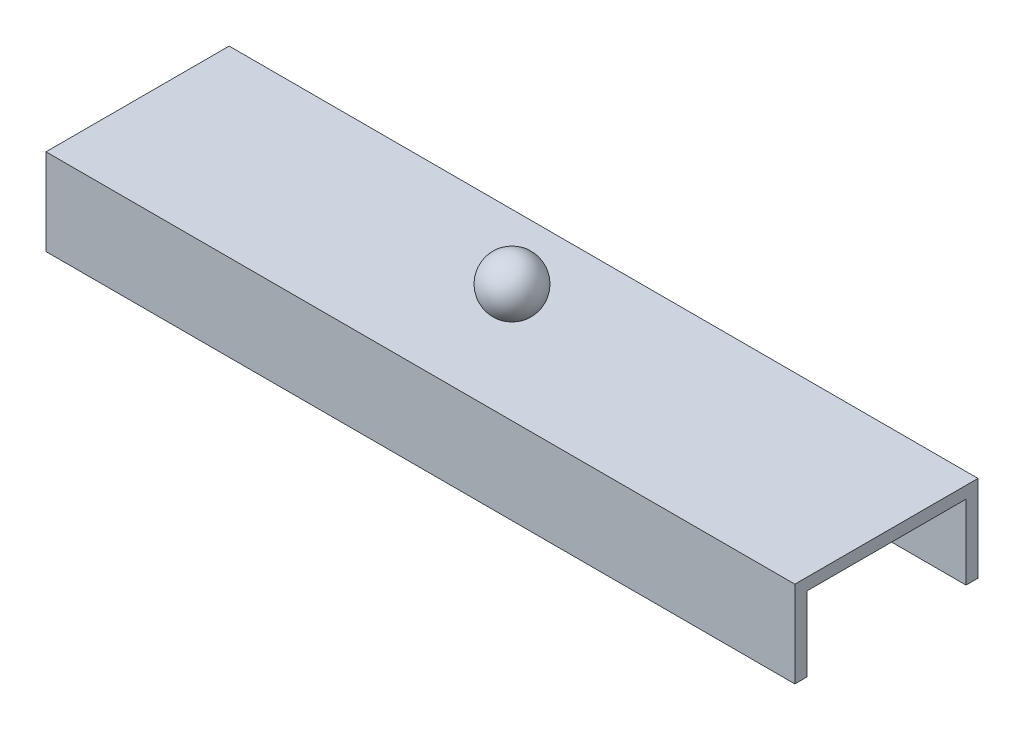
from build123d import *

# Parameters (mm, degrees)
ESBO_O4_W                = 125.2
ESBO_O4_H                = 26.62
RESSALTO_EXTRUS_O1_DEPTH = 2
RESSALTO_EXTRUS_O2_START = 13.31
ESBO_O5_W                = 125.2
ESBO_O5_H                = 14.45
RESSALTO_EXTRUS_O2_DEPTH = 2
RESSALTO_EXTRUS_O3_START = -13.31
ESBO_O6_W                = 125.2
ESBO_O6_H                = 14.45
RESSALTO_EXTRUS_O3_DEPTH = 2


with BuildPart() as part:
    # Esboço3 → Revolução1 (revolve)
    with BuildSketch(Plane.XY):
        with BuildLine():
            Line((0, 0), (0, 9))
            ThreePointArc((0, 9), (-4.5, 4.5), (0, 0))
        make_face()
    revolve(axis=Axis((0, 0, 0), (0, 1, 0)))


with BuildPart() as body_2:
    # Esboço4 → Ressalto-extrusão1 (new body)
    with BuildSketch(Plane(origin=(0, 0, 0), x_dir=(1, 0, 0), z_dir=(0, 1, 0))):
        Rectangle(ESBO_O4_W, ESBO_O4_H)
    extrude(amount=-RESSALTO_EXTRUS_O1_DEPTH)

    # Esboço5 → Ressalto-extrusão2 (add)
    with BuildSketch(Plane.XY.offset(RESSALTO_EXTRUS_O2_START)):
        with Locations((0, -7.225)):
            Rectangle(ESBO_O5_W, ESBO_O5_H)
    extrude(amount=RESSALTO_EXTRUS_O2_DEPTH)

    # Esboço6 → Ressalto-extrusão3 (add)
    with BuildSketch(Plane.XY.offset(RESSALTO_EXTRUS_O3_START)):
        with Locations((0, -7.225)):
            Rectangle(ESBO_O6_W, ESBO_O6_H)
    extrude(amount=-RESSALTO_EXTRUS_O3_DEPTH)


solid = Compound([part.part, body_2.part])
